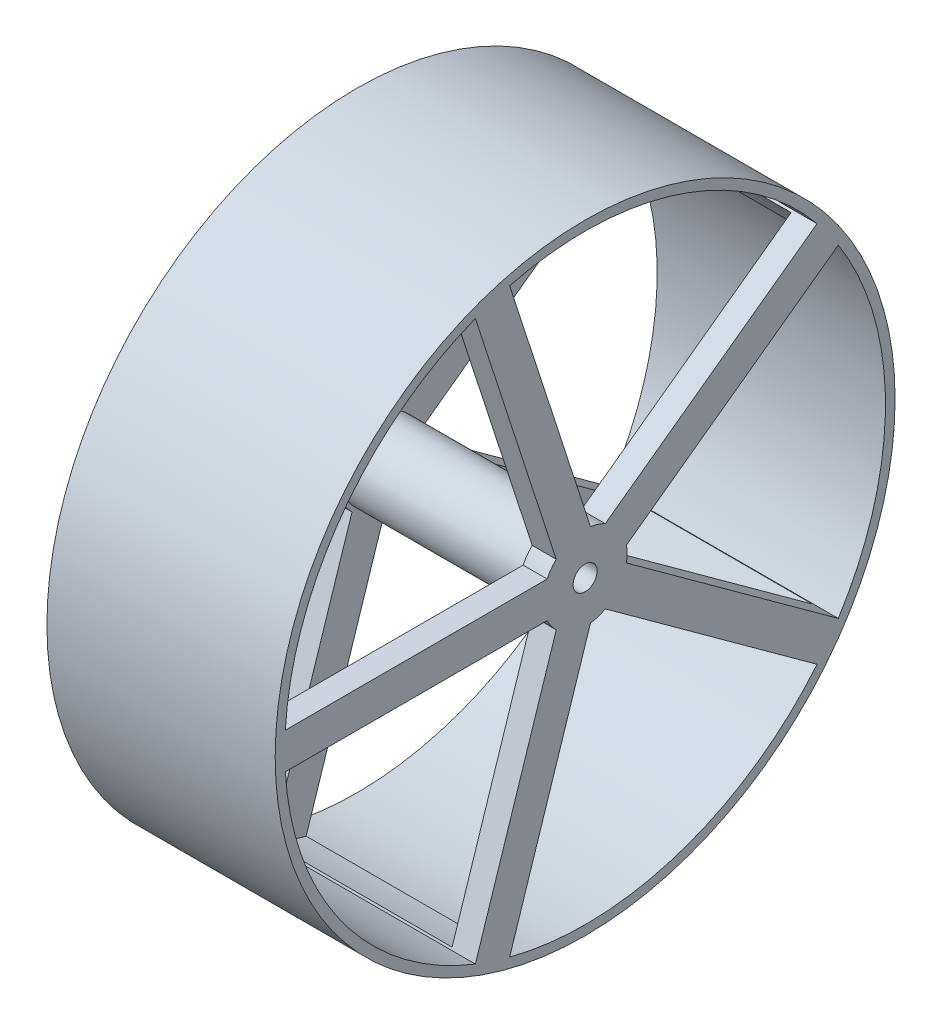
from build123d import *

# Parameters (mm, degrees)
SKETCH2_R           = 129
SKETCH2_R_2         = 17.5
SKETCH2_R_3         = 5
BOSS_EXTRUDE1_DEPTH = 47.5
SKETCH3_W           = 75
SKETCH3_H           = 108.188611699


with BuildPart() as part:
    # Sketch2 → Boss-Extrude1 (new, symmetric)
    # profile 1 of 6: a face of its own
    with BuildSketch(Plane.YZ):
        with Locations(Location((0, 0, 0), (0, 0, 270))):
            Circle(SKETCH2_R)
        with BuildLine():
            Line((-7.5, 124.774797135), (-7.5, 15.811388301))
            ThreePointArc((-7.5, 15.811388301), (0, 17.5), (7.5, 15.811388301))
            Line((7.5, 15.811388301), (7.5, 124.774797135))
            ThreePointArc((7.5, 124.774797135), (73.473156537, 101.127124297), (116.350256427, 45.690456657))
            Line((116.350256427, 45.690456657), (12.719896417, 12.018911562))
            ThreePointArc((12.719896417, 12.018911562), (16.261122152, 6.467295134), (17.5, 0))
            ThreePointArc((17.5, 0), (17.463750289, -1.125800087), (17.355151333, -2.246936183))
            Line((17.355151333, -2.246936183), (120.985511342, 31.424608912))
            ThreePointArc((120.985511342, 31.424608912), (118.882064537, -38.627124297), (79.408413071, -96.536541959))
            Line((79.408413071, -96.536541959), (15.361328319, -8.383292448))
            ThreePointArc((15.361328319, -8.383292448), (10.286241915, -14.157797402), (3.226073404, -17.200071232))
            Line((3.226073404, -17.200071232), (67.273158156, -105.353320744))
            ThreePointArc((67.273158156, -105.353320744), (0, -125), (-67.273158156, -105.353320744))
            Line((-67.273158156, -105.353320744), (-3.226073404, -17.200071232))
            ThreePointArc((-3.226073404, -17.200071232), (-10.286241915, -14.157797402), (-15.361328319, -8.383292448))
            Line((-15.361328319, -8.383292448), (-79.408413071, -96.536541959))
            ThreePointArc((-79.408413071, -96.536541959), (-118.882064537, -38.627124297), (-120.985511342, 31.424608912))
            Line((-120.985511342, 31.424608912), (-17.355151333, -2.246936183))
            ThreePointArc((-17.355151333, -2.246936183), (-16.643489035, 5.407797402), (-12.719896417, 12.018911562))
            Line((-12.719896417, 12.018911562), (-116.350256427, 45.690456657))
            ThreePointArc((-116.350256427, 45.690456657), (-73.473156537, 101.127124297), (-7.5, 124.774797135))
        make_face(mode=Mode.SUBTRACT)
    # profile 2 of 6: a face of its own
    with BuildSketch(Plane.YZ):
        with Locations(Location((0, 0, 0), (0, 0, 270))):
            Circle(SKETCH2_R)
        with BuildLine():
            Line((-7.5, 124.774797135), (-7.5, 15.811388301))
            ThreePointArc((-7.5, 15.811388301), (0, 17.5), (7.5, 15.811388301))
            Line((7.5, 15.811388301), (7.5, 124.774797135))
            ThreePointArc((7.5, 124.774797135), (73.473156537, 101.127124297), (116.350256427, 45.690456657))
            Line((116.350256427, 45.690456657), (12.719896417, 12.018911562))
            ThreePointArc((12.719896417, 12.018911562), (16.261122152, 6.467295134), (17.5, 0))
            ThreePointArc((17.5, 0), (17.463750289, -1.125800087), (17.355151333, -2.246936183))
            Line((17.355151333, -2.246936183), (120.985511342, 31.424608912))
            ThreePointArc((120.985511342, 31.424608912), (118.882064537, -38.627124297), (79.408413071, -96.536541959))
            Line((79.408413071, -96.536541959), (15.361328319, -8.383292448))
            ThreePointArc((15.361328319, -8.383292448), (10.286241915, -14.157797402), (3.226073404, -17.200071232))
            Line((3.226073404, -17.200071232), (67.273158156, -105.353320744))
            ThreePointArc((67.273158156, -105.353320744), (0, -125), (-67.273158156, -105.353320744))
            Line((-67.273158156, -105.353320744), (-3.226073404, -17.200071232))
            ThreePointArc((-3.226073404, -17.200071232), (-10.286241915, -14.157797402), (-15.361328319, -8.383292448))
            Line((-15.361328319, -8.383292448), (-79.408413071, -96.536541959))
            ThreePointArc((-79.408413071, -96.536541959), (-118.882064537, -38.627124297), (-120.985511342, 31.424608912))
            Line((-120.985511342, 31.424608912), (-17.355151333, -2.246936183))
            ThreePointArc((-17.355151333, -2.246936183), (-16.643489035, 5.407797402), (-12.719896417, 12.018911562))
            Line((-12.719896417, 12.018911562), (-116.350256427, 45.690456657))
            ThreePointArc((-116.350256427, 45.690456657), (-73.473156537, 101.127124297), (-7.5, 124.774797135))
        make_face(mode=Mode.SUBTRACT)
    # profile 3 of 6: a face of its own
    with BuildSketch(Plane.YZ):
        with Locations(Location((0, 0, 0), (0, 0, 270))):
            Circle(SKETCH2_R)
        with BuildLine():
            Line((-7.5, 124.774797135), (-7.5, 15.811388301))
            ThreePointArc((-7.5, 15.811388301), (0, 17.5), (7.5, 15.811388301))
            Line((7.5, 15.811388301), (7.5, 124.774797135))
            ThreePointArc((7.5, 124.774797135), (73.473156537, 101.127124297), (116.350256427, 45.690456657))
            Line((116.350256427, 45.690456657), (12.719896417, 12.018911562))
            ThreePointArc((12.719896417, 12.018911562), (16.261122152, 6.467295134), (17.5, 0))
            ThreePointArc((17.5, 0), (17.463750289, -1.125800087), (17.355151333, -2.246936183))
            Line((17.355151333, -2.246936183), (120.985511342, 31.424608912))
            ThreePointArc((120.985511342, 31.424608912), (118.882064537, -38.627124297), (79.408413071, -96.536541959))
            Line((79.408413071, -96.536541959), (15.361328319, -8.383292448))
            ThreePointArc((15.361328319, -8.383292448), (10.286241915, -14.157797402), (3.226073404, -17.200071232))
            Line((3.226073404, -17.200071232), (67.273158156, -105.353320744))
            ThreePointArc((67.273158156, -105.353320744), (0, -125), (-67.273158156, -105.353320744))
            Line((-67.273158156, -105.353320744), (-3.226073404, -17.200071232))
            ThreePointArc((-3.226073404, -17.200071232), (-10.286241915, -14.157797402), (-15.361328319, -8.383292448))
            Line((-15.361328319, -8.383292448), (-79.408413071, -96.536541959))
            ThreePointArc((-79.408413071, -96.536541959), (-118.882064537, -38.627124297), (-120.985511342, 31.424608912))
            Line((-120.985511342, 31.424608912), (-17.355151333, -2.246936183))
            ThreePointArc((-17.355151333, -2.246936183), (-16.643489035, 5.407797402), (-12.719896417, 12.018911562))
            Line((-12.719896417, 12.018911562), (-116.350256427, 45.690456657))
            ThreePointArc((-116.350256427, 45.690456657), (-73.473156537, 101.127124297), (-7.5, 124.774797135))
        make_face(mode=Mode.SUBTRACT)
    # profile 4 of 6: a face of its own
    with BuildSketch(Plane.YZ):
        with Locations(Location((0, 0, 0), (0, 0, 270))):
            Circle(SKETCH2_R)
        with BuildLine():
            Line((-7.5, 124.774797135), (-7.5, 15.811388301))
            ThreePointArc((-7.5, 15.811388301), (0, 17.5), (7.5, 15.811388301))
            Line((7.5, 15.811388301), (7.5, 124.774797135))
            ThreePointArc((7.5, 124.774797135), (73.473156537, 101.127124297), (116.350256427, 45.690456657))
            Line((116.350256427, 45.690456657), (12.719896417, 12.018911562))
            ThreePointArc((12.719896417, 12.018911562), (16.261122152, 6.467295134), (17.5, 0))
            ThreePointArc((17.5, 0), (17.463750289, -1.125800087), (17.355151333, -2.246936183))
            Line((17.355151333, -2.246936183), (120.985511342, 31.424608912))
            ThreePointArc((120.985511342, 31.424608912), (118.882064537, -38.627124297), (79.408413071, -96.536541959))
            Line((79.408413071, -96.536541959), (15.361328319, -8.383292448))
            ThreePointArc((15.361328319, -8.383292448), (10.286241915, -14.157797402), (3.226073404, -17.200071232))
            Line((3.226073404, -17.200071232), (67.273158156, -105.353320744))
            ThreePointArc((67.273158156, -105.353320744), (0, -125), (-67.273158156, -105.353320744))
            Line((-67.273158156, -105.353320744), (-3.226073404, -17.200071232))
            ThreePointArc((-3.226073404, -17.200071232), (-10.286241915, -14.157797402), (-15.361328319, -8.383292448))
            Line((-15.361328319, -8.383292448), (-79.408413071, -96.536541959))
            ThreePointArc((-79.408413071, -96.536541959), (-118.882064537, -38.627124297), (-120.985511342, 31.424608912))
            Line((-120.985511342, 31.424608912), (-17.355151333, -2.246936183))
            ThreePointArc((-17.355151333, -2.246936183), (-16.643489035, 5.407797402), (-12.719896417, 12.018911562))
            Line((-12.719896417, 12.018911562), (-116.350256427, 45.690456657))
            ThreePointArc((-116.350256427, 45.690456657), (-73.473156537, 101.127124297), (-7.5, 124.774797135))
        make_face(mode=Mode.SUBTRACT)
    # profile 5 of 6: a face of its own
    with BuildSketch(Plane.YZ):
        with Locations(Location((0, 0, 0), (0, 0, 270))):
            Circle(SKETCH2_R)
        with BuildLine():
            Line((-7.5, 124.774797135), (-7.5, 15.811388301))
            ThreePointArc((-7.5, 15.811388301), (0, 17.5), (7.5, 15.811388301))
            Line((7.5, 15.811388301), (7.5, 124.774797135))
            ThreePointArc((7.5, 124.774797135), (73.473156537, 101.127124297), (116.350256427, 45.690456657))
            Line((116.350256427, 45.690456657), (12.719896417, 12.018911562))
            ThreePointArc((12.719896417, 12.018911562), (16.261122152, 6.467295134), (17.5, 0))
            ThreePointArc((17.5, 0), (17.463750289, -1.125800087), (17.355151333, -2.246936183))
            Line((17.355151333, -2.246936183), (120.985511342, 31.424608912))
            ThreePointArc((120.985511342, 31.424608912), (118.882064537, -38.627124297), (79.408413071, -96.536541959))
            Line((79.408413071, -96.536541959), (15.361328319, -8.383292448))
            ThreePointArc((15.361328319, -8.383292448), (10.286241915, -14.157797402), (3.226073404, -17.200071232))
            Line((3.226073404, -17.200071232), (67.273158156, -105.353320744))
            ThreePointArc((67.273158156, -105.353320744), (0, -125), (-67.273158156, -105.353320744))
            Line((-67.273158156, -105.353320744), (-3.226073404, -17.200071232))
            ThreePointArc((-3.226073404, -17.200071232), (-10.286241915, -14.157797402), (-15.361328319, -8.383292448))
            Line((-15.361328319, -8.383292448), (-79.408413071, -96.536541959))
            ThreePointArc((-79.408413071, -96.536541959), (-118.882064537, -38.627124297), (-120.985511342, 31.424608912))
            Line((-120.985511342, 31.424608912), (-17.355151333, -2.246936183))
            ThreePointArc((-17.355151333, -2.246936183), (-16.643489035, 5.407797402), (-12.719896417, 12.018911562))
            Line((-12.719896417, 12.018911562), (-116.350256427, 45.690456657))
            ThreePointArc((-116.350256427, 45.690456657), (-73.473156537, 101.127124297), (-7.5, 124.774797135))
        make_face(mode=Mode.SUBTRACT)
    # profile 6 of 6: a face of its own
    with BuildSketch(Plane.YZ):
        Circle(SKETCH2_R_2)
        with Locations(Location((0, 0, 0), (0, 0, 270))):
            Circle(SKETCH2_R_3, mode=Mode.SUBTRACT)
    extrude(amount=BOSS_EXTRUDE1_DEPTH, both=True)

    # Sketch3 → Cut-Revolve1 (revolve, cut)
    with BuildSketch(Plane(origin=(0, 0, 0), x_dir=(-1, 0, 0), z_dir=(0, 1, 0)), mode=Mode.PRIVATE) as cut_revolve1_sk:
        with Locations((0, 69.905694151)):
            Rectangle(SKETCH3_W, SKETCH3_H)
    revolve(cut_revolve1_sk.sketch.rotate(Axis((1000, 0, 0), (-1, 0, 0)), 180), axis=Axis((1000, 0, 0), (-1, 0, 0)), mode=Mode.SUBTRACT)


solid = part.part
